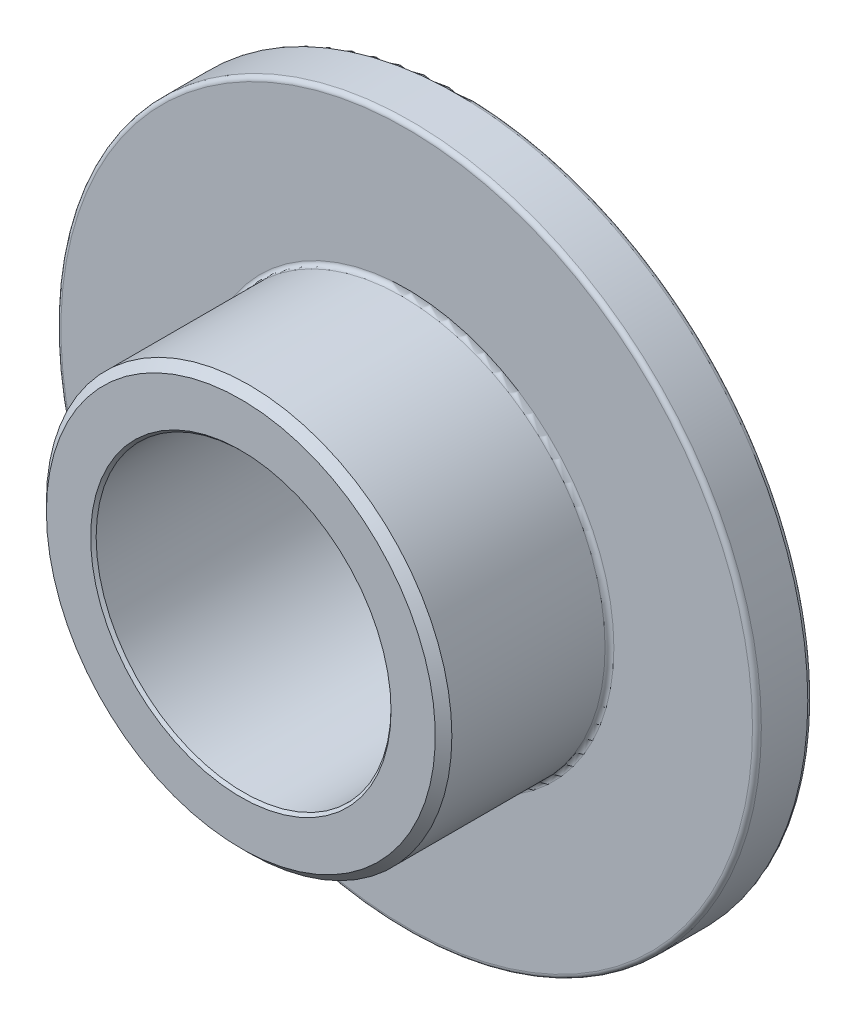
from build123d import *

# Parameters (mm, degrees)
CHAMFER1_SIZE = 0.1125
CHAMFER2_SIZE = 0.0375
FILLET1_R     = 0.06


with BuildPart() as part:
    # Sketch3 → Revolve1 (revolve)
    with BuildSketch(Plane(origin=(0, 0, 0), x_dir=(0, 0, -1), z_dir=(1, 0, 0)), mode=Mode.PRIVATE) as revolve1_sk:
        Polygon((1.5, -4.75), (0.75, -4.75), (0.75, -2.75), (-1.5, -2.75), (-1.5, -2), (1.5, -2), align=None)
    revolve(revolve1_sk.sketch.rotate(Axis((0, 0, 1.5), (0, 0, -1)), 270), axis=Axis((0, 0, 1.5), (0, 0, -1)))

    # Chamfer1
    chamfer1_edges = [part.edges().sort_by_distance(p)[0] for p in [
        (-2.75, 0, 1.5),
    ]]
    chamfer(chamfer1_edges, length=CHAMFER1_SIZE)

    # Chamfer2
    chamfer2_edges = [part.edges().sort_by_distance(p)[0] for p in [
        (-2, 0, -1.5),
        (-2, 0, 1.5),
    ]]
    chamfer(chamfer2_edges, length=CHAMFER2_SIZE)

    # Fillet1
    fillet1_edges = [part.edges().sort_by_distance(p)[0] for p in [
        (-2.75, 0, -0.75),
        (-4.75, 0, -0.75),
        (-4.75, 0, -1.5),
    ]]
    fillet(fillet1_edges, radius=FILLET1_R)


solid = part.part
